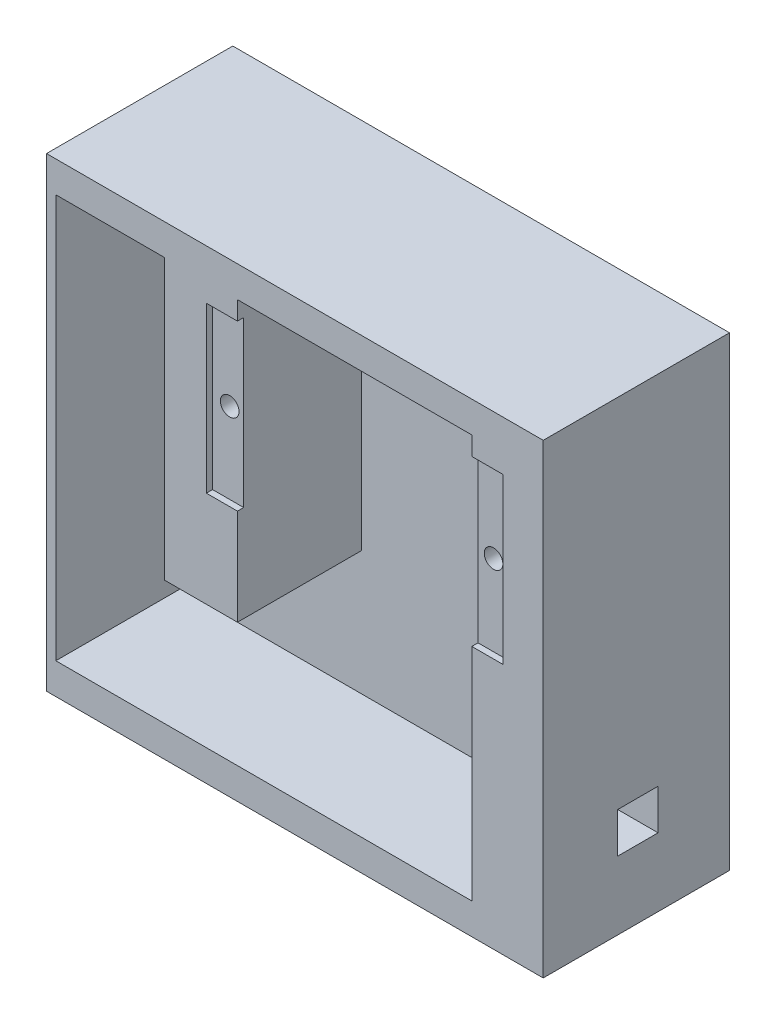
from build123d import *

# Parameters (mm, degrees)
SKETCH2_W           = 160
SKETCH2_H           = 150
BOSS_EXTRUDE1_DEPTH = 60
CUT_EXTRUDE1_DEPTH  = 40
SKETCH4_R           = 3
CUT_EXTRUDE2_DEPTH  = 60
SKETCH5_W           = 13
SKETCH5_H           = 13
CUT_EXTRUDE3_DEPTH  = 50
SKETCH6_W           = 10
SKETCH6_H           = 53
CUT_EXTRUDE4_DEPTH  = 2
SKETCH7_W           = 35
SKETCH7_H           = 130
CUT_EXTRUDE5_DEPTH  = 40


with BuildPart() as part:
    # Sketch2 → Boss-Extrude1 (new body)
    with BuildSketch(Plane.XY):
        with Locations((-80, -75)):
            Rectangle(SKETCH2_W, SKETCH2_H)
    extrude(amount=BOSS_EXTRUDE1_DEPTH)

    # Sketch3 → Cut-Extrude1 (cut)
    with BuildSketch(Plane.XY.offset(60)):
        Polygon((-98.5, -10), (-23, -10), (-23, -140), (-157, -140), (-157, -100), (-98.5, -100), align=None)
    extrude(amount=-CUT_EXTRUDE1_DEPTH, mode=Mode.SUBTRACT)

    # Sketch4 → Cut-Extrude2 (cut)
    with BuildSketch(Plane.XY.offset(60)):
        with Locations((-103, -43)):
            Circle(SKETCH4_R)
        with Locations((-18, -43)):
            Circle(SKETCH4_R)
    extrude(amount=-CUT_EXTRUDE2_DEPTH, mode=Mode.SUBTRACT)

    # Sketch5 → Cut-Extrude3 (cut)
    with BuildSketch(Plane(origin=(0, 0, 0), x_dir=(0, 0, -1), z_dir=(1, 0, 0))):
        with Locations((-29.5, -121.5)):
            Rectangle(SKETCH5_W, SKETCH5_H)
    extrude(amount=-CUT_EXTRUDE3_DEPTH, mode=Mode.SUBTRACT)

    # Sketch6 → Cut-Extrude4 (cut)
    with BuildSketch(Plane.XY.offset(60)):
        with Locations((-103.5, -42.5)):
            Rectangle(SKETCH6_W, SKETCH6_H)
        with Locations((-18, -42.5)):
            Rectangle(SKETCH6_W, SKETCH6_H)
    extrude(amount=-CUT_EXTRUDE4_DEPTH, mode=Mode.SUBTRACT)

    # Sketch7 → Cut-Extrude5 (cut)
    with BuildSketch(Plane.XY.offset(60)):
        with Locations((-139.5, -75)):
            Rectangle(SKETCH7_W, SKETCH7_H)
    extrude(amount=-CUT_EXTRUDE5_DEPTH, mode=Mode.SUBTRACT)


solid = part.part
